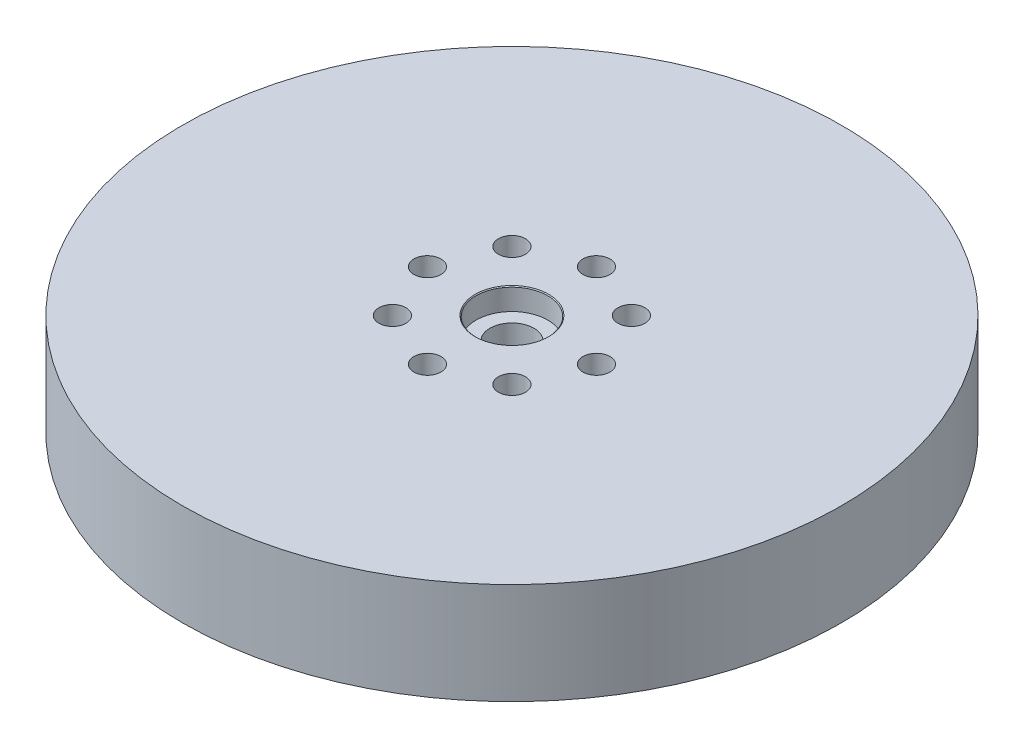
from build123d import *
from build123d.topology import SkipClean

# Parameters (mm, degrees)
CUT_EXTRUDE1_DEPTH      = 286.527581855
CUT_EXTRUDE1_DEPTH_BACK = 286.527581855
SKETCH2_R               = 4
SKETCH4_R               = 8
CUT_EXTRUDE3_DEPTH      = 12
BOSS_EXTRUDE1_START     = 30
SKETCH5_R               = 74.5
SKETCH5_R_2             = 4
SKETCH5_R_3             = 13
BOSS_EXTRUDE1_DEPTH     = 1
SKETCH6_R               = 74.5
CUT_EXTRUDE4_DEPTH      = 2.5
BOSS_EXTRUDE3_START     = 0.01
SKETCH7_R               = 2.6
BOSS_EXTRUDE3_DEPTH     = 5
SKETCH8_R               = 2.6
BOSS_EXTRUDE4_DEPTH     = 5
CHAMFER3_SIZE           = 3.5
CHAMFER4_SIZE           = 3.5
SKETCH9_R               = 2.6
CUT_EXTRUDE5_DEPTH      = 15
SKETCH10_R              = 65
SKETCH10_R_2            = 35
SKETCH10_R_3            = 4
BOSS_EXTRUDE5_DEPTH     = 10
FILLET1_R               = 1


with BuildPart() as part:
    # Sketch1 → Revolve1 (revolve)
    with BuildSketch(Plane(origin=(0, 0, 0), x_dir=(0, 0, -1), z_dir=(1, 0, 0))):
        Polygon((-195, 60), (-195, 0), (-185.5, 0), (-185.5, 10), (-74.5, 10), (-74.5, 0), (-74.5, -14), (-15.5, -14), (-13, -11.5), (-13, 47), (-21.25, 47), (-21.25, 59.5), (-21.75, 60), (-74.5, 60), (-185.5, 60), align=None)
    revolve(axis=Axis((0, -14, 0), (0, -1, 0)))

    # Sketch2 → Cut-Extrude1 (cut, two sides: drawn at the far end of the back side and taken through both)
    with BuildSketch(Plane(origin=(0, 60, 0), x_dir=(1, 0, 0), z_dir=(0, 1, 0)).offset(-CUT_EXTRUDE1_DEPTH_BACK)):
        with Locations(Location((-50, 0, 0), (0, 0, 270))):
            Circle(SKETCH2_R)
        with Locations(Location((-35.355339059, 35.355339059, 0), (0, 0, 270))):
            Circle(SKETCH2_R)
        with Locations(Location((0, 50, 0), (0, 0, 270))):
            Circle(SKETCH2_R)
        with Locations(Location((35.355339059, 35.355339059, 0), (0, 0, 270))):
            Circle(SKETCH2_R)
        with Locations(Location((50, 0, 0), (0, 0, 270))):
            Circle(SKETCH2_R)
        with Locations(Location((35.355339059, -35.355339059, 0), (0, 0, 270))):
            Circle(SKETCH2_R)
        with Locations(Location((0, -50, 0), (0, 0, 270))):
            Circle(SKETCH2_R)
        with Locations(Location((-35.355339059, -35.355339059, 0), (0, 0, 270))):
            Circle(SKETCH2_R)
    extrude(amount=CUT_EXTRUDE1_DEPTH + CUT_EXTRUDE1_DEPTH_BACK, mode=Mode.SUBTRACT)

    # Sketch4 → Cut-Extrude3 (cut)
    with BuildSketch(Plane(origin=(0, 60, 0), x_dir=(1, 0, 0), z_dir=(0, 1, 0))):
        with Locations(Location((0, 50, 0), (0, 0, 270))):
            Circle(SKETCH4_R)
        with Locations(Location((35.355339059, 35.355339059, 0), (0, 0, 270))):
            Circle(SKETCH4_R)
        with Locations(Location((50, 0, 0), (0, 0, 270))):
            Circle(SKETCH4_R)
        with Locations(Location((35.355339059, -35.355339059, 0), (0, 0, 270))):
            Circle(SKETCH4_R)
        with Locations(Location((0, -50, 0), (0, 0, 270))):
            Circle(SKETCH4_R)
        with Locations(Location((-35.355339059, -35.355339059, 0), (0, 0, 270))):
            Circle(SKETCH4_R)
        with Locations(Location((-50, 0, 0), (0, 0, 270))):
            Circle(SKETCH4_R)
        with Locations(Location((-35.355339059, 35.355339059, 0), (0, 0, 270))):
            Circle(SKETCH4_R)
    extrude(amount=-CUT_EXTRUDE3_DEPTH, mode=Mode.SUBTRACT)

    # Sketch6 → Cut-Extrude4 (cut)
    with BuildSketch(Plane.XZ.offset(14)):
        with Locations(Location((0, 0, 0), (0, 0, 270))):
            Circle(SKETCH6_R)
    extrude(amount=-CUT_EXTRUDE4_DEPTH, mode=Mode.SUBTRACT)

    # Sketch9 → Cut-Extrude5 (cut)
    with BuildSketch(Plane.XZ.offset(-10)):
        with Locations(Location((0, 157, 0), (0, 0, 270))):
            Circle(SKETCH9_R)
        with Locations(Location((0, 102, 0), (0, 0, 270))):
            Circle(SKETCH9_R)
        with Locations(Location((111.015764646, 111.015764646, 0), (0, 0, 270))):
            Circle(SKETCH9_R)
        with Locations(Location((72.124891681, 72.124891681, 0), (0, 0, 270))):
            Circle(SKETCH9_R)
        with Locations(Location((157, 0, 0), (0, 0, 270))):
            Circle(SKETCH9_R)
        with Locations(Location((102, 0, 0), (0, 0, 270))):
            Circle(SKETCH9_R)
        with Locations(Location((111.015764646, -111.015764646, 0), (0, 0, 270))):
            Circle(SKETCH9_R)
        with Locations(Location((72.124891681, -72.124891681, 0), (0, 0, 270))):
            Circle(SKETCH9_R)
        with Locations(Location((0, -157, 0), (0, 0, 270))):
            Circle(SKETCH9_R)
        with Locations(Location((0, -102, 0), (0, 0, 270))):
            Circle(SKETCH9_R)
        with Locations(Location((-111.015764646, -111.015764646, 0), (0, 0, 270))):
            Circle(SKETCH9_R)
        with Locations(Location((-72.124891681, -72.124891681, 0), (0, 0, 270))):
            Circle(SKETCH9_R)
        with Locations(Location((-157, 0, 0), (0, 0, 270))):
            Circle(SKETCH9_R)
        with Locations(Location((-102, 0, 0), (0, 0, 270))):
            Circle(SKETCH9_R)
        with Locations(Location((-111.015764646, 111.015764646, 0), (0, 0, 270))):
            Circle(SKETCH9_R)
        with Locations(Location((-72.124891681, 72.124891681, 0), (0, 0, 270))):
            Circle(SKETCH9_R)
    extrude(amount=-CUT_EXTRUDE5_DEPTH, mode=Mode.SUBTRACT)

    # Sketch10 → Boss-Extrude5 (add)
    with SkipClean():  # the faces are left unmerged after this step: merging them gives an invalid solid
        with BuildSketch(Plane.XZ.offset(11.5)):
            with Locations(Location((0, 0, 0), (0, 0, 270))):
                Circle(SKETCH10_R)
            with Locations(Location((0, 0, 0), (0, 0, 270))):
                Circle(SKETCH10_R_2, mode=Mode.SUBTRACT)
            with Locations(Location((50, 0, 0), (0, 0, 270))):
                Circle(SKETCH10_R_3, mode=Mode.SUBTRACT)
            with Locations(Location((35.355339059, -35.355339059, 0), (0, 0, 270))):
                Circle(SKETCH10_R_3, mode=Mode.SUBTRACT)
            with Locations(Location((0, -50, 0), (0, 0, 270))):
                Circle(SKETCH10_R_3, mode=Mode.SUBTRACT)
            with Locations(Location((-35.355339059, -35.355339059, 0), (0, 0, 270))):
                Circle(SKETCH10_R_3, mode=Mode.SUBTRACT)
            with Locations(Location((-50, 0, 0), (0, 0, 270))):
                Circle(SKETCH10_R_3, mode=Mode.SUBTRACT)
            with Locations(Location((-35.355339059, 35.355339059, 0), (0, 0, 270))):
                Circle(SKETCH10_R_3, mode=Mode.SUBTRACT)
            with Locations(Location((0, 50, 0), (0, 0, 270))):
                Circle(SKETCH10_R_3, mode=Mode.SUBTRACT)
            with Locations(Location((35.355339059, 35.355339059, 0), (0, 0, 270))):
                Circle(SKETCH10_R_3, mode=Mode.SUBTRACT)
        extrude(amount=BOSS_EXTRUDE5_DEPTH)

    # Fillet1
    fillet1_edges = [part.edges().sort_by_distance(p)[0] for p in [
        (0, -11.5, -74.5),
        (0, 10, -74.5),
        (0, -11.5, 65),
        (0, -21.5, 65),
        (0, -21.5, 35),
        (50, -21.5, 4),
        (35.355339059, -21.5, -31.355339059),
        (0, -21.5, -46),
        (-35.355339059, -21.5, -31.355339059),
        (-50, -21.5, 4),
        (-35.355339059, -21.5, 39.355339059),
        (0, -21.5, 54),
        (35.355339059, -21.5, 39.355339059),
    ]]
    fillet(fillet1_edges, radius=FILLET1_R)


with BuildPart() as body_2:
    # Sketch5 → Boss-Extrude1 (new body)
    with BuildSketch(Plane.XZ.offset(14).offset(BOSS_EXTRUDE1_START)):
        with Locations(Location((0, 0, 0), (0, 0, 270))):
            Circle(SKETCH5_R)
        with Locations(Location((35.355339059, -35.355339059, 0), (0, 0, 270))):
            Circle(SKETCH5_R_2, mode=Mode.SUBTRACT)
        with Locations(Location((0, -50, 0), (0, 0, 270))):
            Circle(SKETCH5_R_2, mode=Mode.SUBTRACT)
        with Locations(Location((-35.355339059, -35.355339059, 0), (0, 0, 270))):
            Circle(SKETCH5_R_2, mode=Mode.SUBTRACT)
        with Locations(Location((-50, 0, 0), (0, 0, 270))):
            Circle(SKETCH5_R_2, mode=Mode.SUBTRACT)
        with Locations(Location((50, 0, 0), (0, 0, 270))):
            Circle(SKETCH5_R_2, mode=Mode.SUBTRACT)
        with Locations(Location((35.355339059, 35.355339059, 0), (0, 0, 270))):
            Circle(SKETCH5_R_2, mode=Mode.SUBTRACT)
        with Locations(Location((-35.355339059, 35.355339059, 0), (0, 0, 270))):
            Circle(SKETCH5_R_2, mode=Mode.SUBTRACT)
        with Locations(Location((0, 50, 0), (0, 0, 270))):
            Circle(SKETCH5_R_2, mode=Mode.SUBTRACT)
        with Locations(Location((0, 0, 0), (0, 0, 270))):
            Circle(SKETCH5_R_3, mode=Mode.SUBTRACT)
    extrude(amount=BOSS_EXTRUDE1_DEPTH)


with BuildPart() as body_3:
    # Sketch7 → Boss-Extrude3 (new body)
    with BuildSketch(Plane.XZ.offset(-10).offset(BOSS_EXTRUDE3_START)):
        with BuildLine():
            Line((28.238679848, 69.480766838), (69.951551813, 170.184548062))
            ThreePointArc((69.951551813, 170.184548062), (0, 184), (-69.951551813, 170.184548062))
            Line((-69.951551813, 170.184548062), (-28.238679848, 69.480766838))
            ThreePointArc((-28.238679848, 69.480766838), (0, 75), (28.238679848, 69.480766838))
        make_face()
        with Locations(Location((0, 157, 0), (0, 0, 270))):
            Circle(SKETCH7_R, mode=Mode.SUBTRACT)
        with Locations(Location((0, 102, 0), (0, 0, 90))):
            Circle(SKETCH7_R, mode=Mode.SUBTRACT)
    extrude(amount=BOSS_EXTRUDE3_DEPTH)

    # Chamfer4
    chamfer4_edges = [body_3.edges().sort_by_distance(p)[0] for p in [
        (0, 9.99, 159.6),
        (0, 9.99, 99.4),
    ]]
    chamfer(chamfer4_edges, length=CHAMFER4_SIZE)


with BuildPart() as body_4:
    # Sketch8 → Boss-Extrude4 (new body)
    with BuildSketch(Plane.XZ.offset(-4.99)):
        with BuildLine():
            Line((28.238679848, 69.480766838), (69.951551813, 170.184548062))
            ThreePointArc((69.951551813, 170.184548062), (0, 184), (-69.951551813, 170.184548062))
            Line((-69.951551813, 170.184548062), (-28.238679848, 69.480766838))
            ThreePointArc((-28.238679848, 69.480766838), (0, 75), (28.238679848, 69.480766838))
        make_face()
        with Locations(Location((0, 102, 0), (0, 0, 270))):
            Circle(SKETCH8_R, mode=Mode.SUBTRACT)
        with Locations(Location((0, 157, 0), (0, 0, 270))):
            Circle(SKETCH8_R, mode=Mode.SUBTRACT)
    extrude(amount=BOSS_EXTRUDE4_DEPTH)

    # Chamfer3
    chamfer3_edges = [body_4.edges().sort_by_distance(p)[0] for p in [
        (0, -0.01, 104.6),
        (0, -0.01, 159.6),
    ]]
    chamfer(chamfer3_edges, length=CHAMFER3_SIZE)


solid = Compound([part.part, body_2.part, body_3.part, body_4.part])
